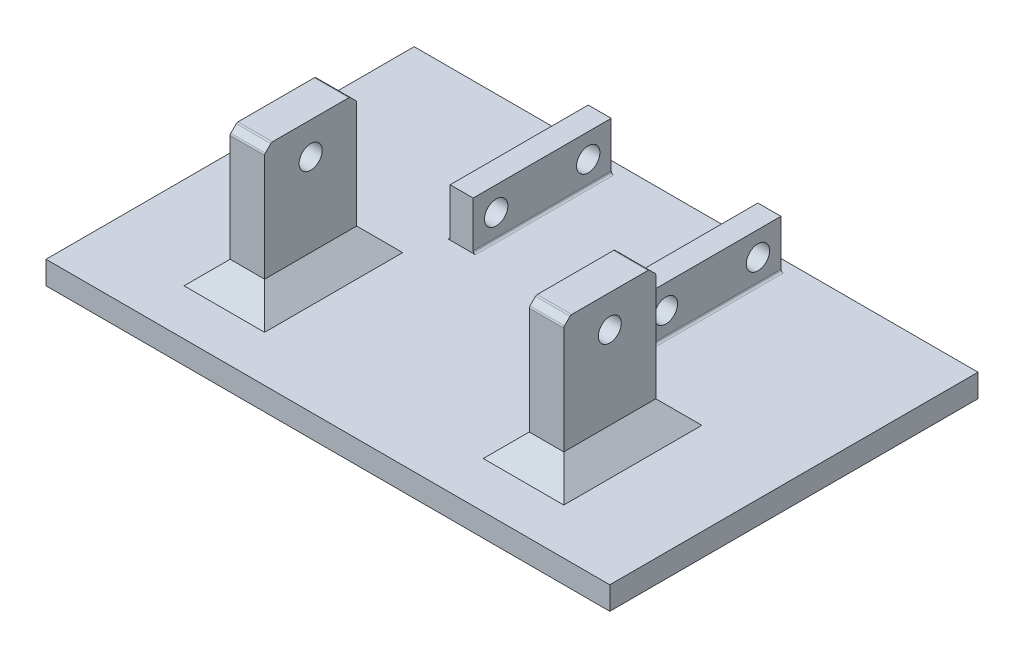
from build123d import *

# Parameters (mm, degrees)
SKETCH1_W           = 245
SKETCH1_H           = 160
BOSS_EXTRUDE1_DEPTH = 10
SKETCH2_W           = 15
SKETCH2_H           = 40
BOSS_EXTRUDE3_DEPTH = 60
SKETCH3_R           = 5
CUT_EXTRUDE1_DEPTH  = 146
CHAMFER1_SIZE       = 10
CHAMFER2_SIZE       = 3
FILLET1_R           = 1
SKETCH4_W           = 10
SKETCH4_H           = 60
BOSS_EXTRUDE4_DEPTH = 20.85
SKETCH7_R           = 5.075
CUT_EXTRUDE2_DEPTH  = 86
FILLET2_R           = 1


with BuildPart() as part:
    # Sketch1 → Boss-Extrude1 (new body)
    with BuildSketch(Plane(origin=(0, 0, 0), x_dir=(1, 0, 0), z_dir=(0, 1, 0))):
        with Locations((122.5, 80)):
            Rectangle(SKETCH1_W, SKETCH1_H)
    extrude(amount=BOSS_EXTRUDE1_DEPTH)

    # Sketch2 → Boss-Extrude3 (add)
    with BuildSketch(Plane(origin=(0, 10, 0), x_dir=(1, 0, 0), z_dir=(0, 1, 0))):
        with Locations((57.5, 50)):
            Rectangle(SKETCH2_W, SKETCH2_H)
        with Locations((187.5, 50)):
            Rectangle(SKETCH2_W, SKETCH2_H)
    extrude(amount=BOSS_EXTRUDE3_DEPTH)

    # Sketch3 → Cut-Extrude1 (cut)
    with BuildSketch(Plane(origin=(195, 0, 0), x_dir=(0, 0, -1), z_dir=(1, 0, 0))):
        with Locations((50, 56)):
            Circle(SKETCH3_R)
    extrude(amount=-CUT_EXTRUDE1_DEPTH, mode=Mode.SUBTRACT)

    # Chamfer1
    chamfer1_edges = [part.edges().sort_by_distance(p)[0] for p in [
        (65, 10, -50),
        (57.5, 10, -70),
        (50, 10, -50),
        (57.5, 10, -30),
        (195, 10, -50),
        (187.5, 10, -70),
        (180, 10, -50),
        (187.5, 10, -30),
    ]]
    chamfer(chamfer1_edges, length=CHAMFER1_SIZE)

    # Chamfer2
    chamfer2_edges = [part.edges().sort_by_distance(p)[0] for p in [
        (57.5, 70, -70),
        (57.5, 70, -30),
        (187.5, 70, -70),
        (187.5, 70, -30),
    ]]
    chamfer(chamfer2_edges, length=CHAMFER2_SIZE)

    # Fillet1
    fillet1_edges = [part.edges().sort_by_distance(p)[0] for p in [
        (57.5, 70, -67),
        (57.5, 70, -33),
        (57.5, 67, -30),
        (57.5, 67, -70),
        (187.5, 70, -33),
        (187.5, 70, -67),
        (187.5, 67, -70),
        (187.5, 67, -30),
    ]]
    fillet(fillet1_edges, radius=FILLET1_R)

    # Sketch4 → Boss-Extrude4 (add)
    with BuildSketch(Plane(origin=(0, 10, 0), x_dir=(1, 0, 0), z_dir=(0, 1, 0))):
        with Locations((85.625, 125)):
            Rectangle(SKETCH4_W, SKETCH4_H)
        with Locations((159.375, 125)):
            Rectangle(SKETCH4_W, SKETCH4_H)
    extrude(amount=BOSS_EXTRUDE4_DEPTH)

    # Sketch7 → Cut-Extrude2 (cut)
    with BuildSketch(Plane(origin=(164.375, 0, 0), x_dir=(0, 0, -1), z_dir=(1, 0, 0))):
        with Locations((105, 20.425)):
            Circle(SKETCH7_R)
        with Locations((145, 20.425)):
            Circle(SKETCH7_R)
    extrude(amount=-CUT_EXTRUDE2_DEPTH, mode=Mode.SUBTRACT)

    # Fillet2
    fillet2_edges = [part.edges().sort_by_distance(p)[0] for p in [
        (90.625, 10, -125),
        (80.625, 10, -125),
        (164.375, 10, -125),
        (154.375, 10, -125),
    ]]
    fillet(fillet2_edges, radius=FILLET2_R)


solid = part.part
